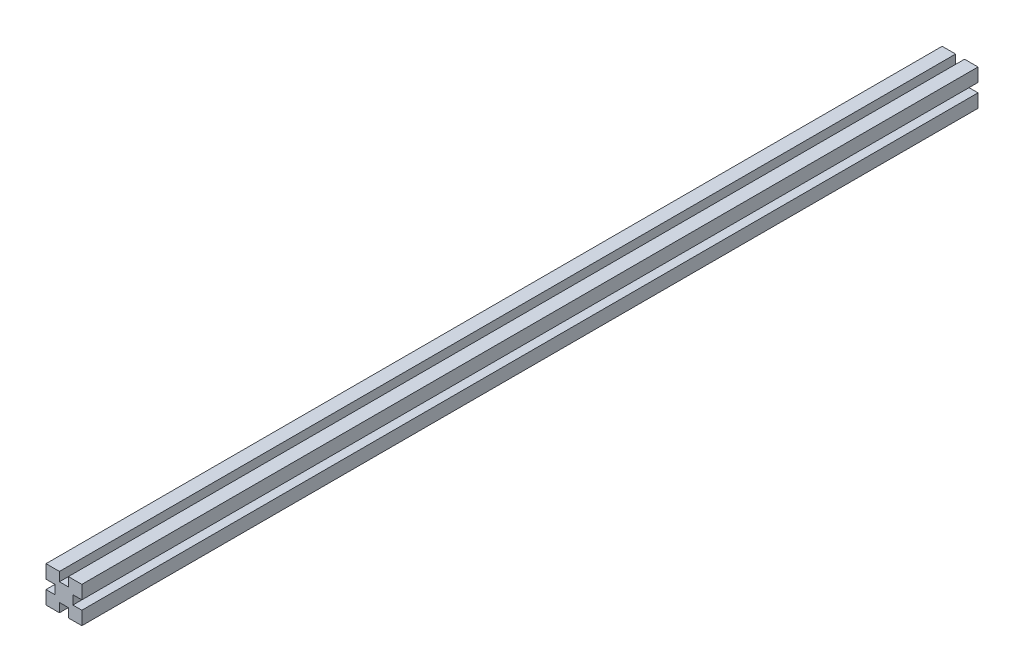
from build123d import *

# Parameters (mm, degrees)
EXTRUDE_1_DEPTH = 500


with BuildPart() as part:
    # 草图1 → 凸台-拉伸1 (new body)
    with BuildSketch(Plane.XY):
        Polygon((2.5, 10), (2.5, 5), (-2.5, 5), (-2.5, 10), (-10, 10), (-10, 2.5), (-5, 2.5), (-5, -2.5), (-10, -2.5), (-10, -10), (-2.5, -10), (-2.5, -5), (2.5, -5), (2.5, -10), (10, -10), (10, -2.5), (5, -2.5), (5, 2.5), (10, 2.5), (10, 10), align=None)
    extrude(amount=EXTRUDE_1_DEPTH)


solid = part.part
